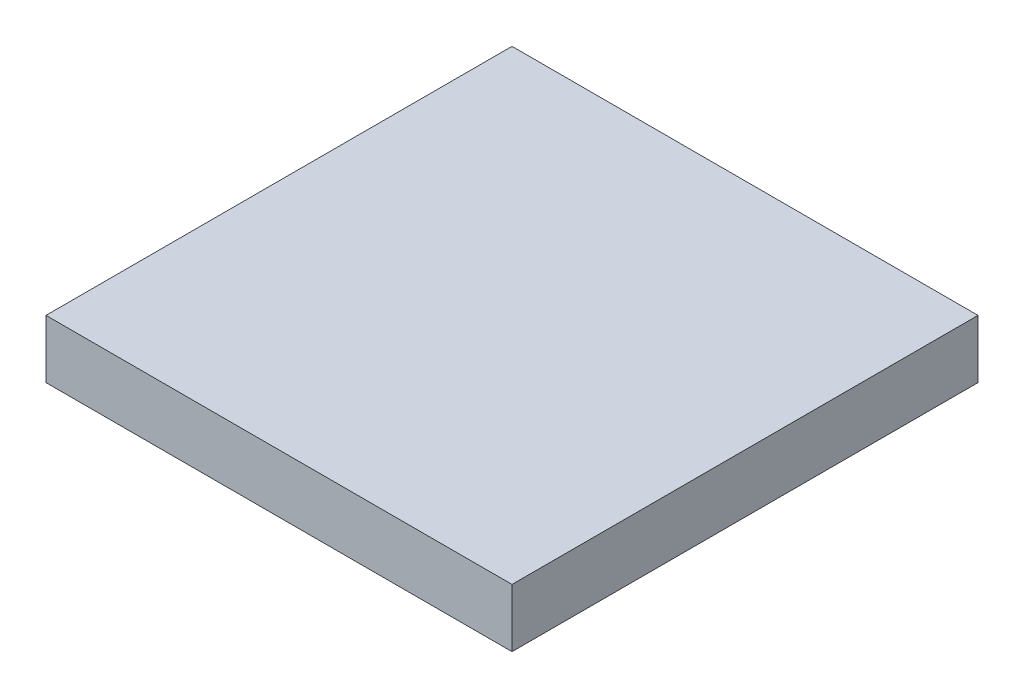
from build123d import *

# Parameters (mm, degrees)
SKETCH1_W           = 12.7
SKETCH1_H           = 12.7
BOSS_EXTRUDE1_DEPTH = 1.5875


with BuildPart() as part:
    # Sketch1 → Boss-Extrude1 (new body)
    with BuildSketch(Plane(origin=(0, 0, 0), x_dir=(1, 0, 0), z_dir=(0, 1, 0))):
        with Locations((6.35, 6.35)):
            Rectangle(SKETCH1_W, SKETCH1_H)
    extrude(amount=BOSS_EXTRUDE1_DEPTH)


solid = part.part
